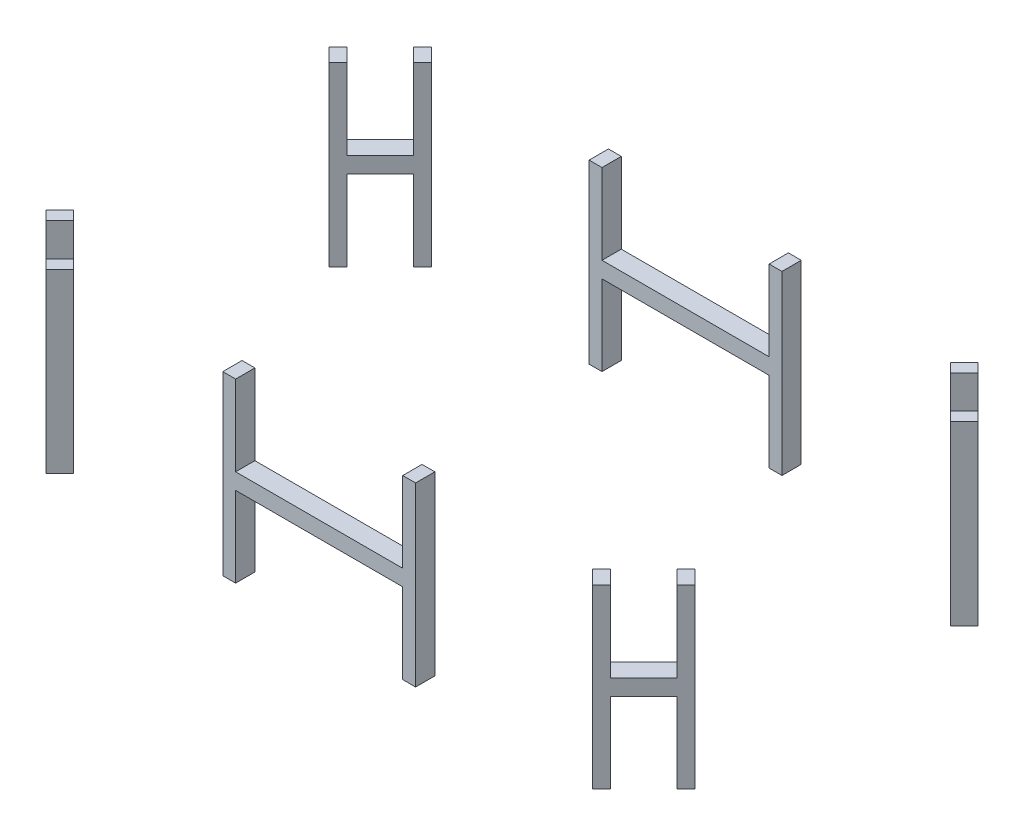
from build123d import *

# Parameters (mm, degrees)
EXTRUDE_1_DEPTH          = 275
EXTRUDE_1_2_DEPTH        = 275
EXTRUDE_1_3_DEPTH        = 275
EXTRUDE_1_4_DEPTH        = 275
EXTRUDE_1_5_DEPTH        = 275
EXTRUDE_1_6_DEPTH        = 275
CUT_EXTRUDE_1_DEPTH      = 832.053548215
CUT_EXTRUDE_1_DEPTH_BACK = 832.053548215
SKETCH_2_W               = 260
SKETCH_2_H               = 125
SKETCH_3_W               = 73.13708499
SKETCH_3_H               = 125
CUT_EXTRUDE_2_DEPTH      = 30
SKETCH_4_W               = 73.13708499
SKETCH_4_H               = 125
CUT_EXTRUDE_3_DEPTH      = 30
SKETCH_5_W               = 73.13708499
SKETCH_5_H               = 125
CUT_EXTRUDE_4_DEPTH      = 30
SKETCH_6_W               = 73.13708499
SKETCH_6_H               = 125
CUT_EXTRUDE_5_DEPTH      = 30


with BuildPart() as part:
    # 草图1 → 凸台-拉伸1 (new body)
    with BuildSketch(Plane(origin=(0, 0, 0), x_dir=(1, 0, 0), z_dir=(0, 1, 0))):
        Polygon((-505, 220), (-425, 300), (-403.786796564, 278.786796564), (-483.786796564, 198.786796564), align=None)
    extrude(amount=EXTRUDE_1_DEPTH)

    # 草图5 → 切除-拉伸4 (cut)
    with BuildSketch(Plane(origin=(-362.5, 0, -362.5), x_dir=(-0.7071067811865475, 0, 0.7071067811865477), z_dir=(-0.7071067811865477, 0, -0.7071067811865475))):
        with Locations((144.956890143, 212.5)):
            Rectangle(SKETCH_5_W, SKETCH_5_H)
        with Locations((144.956890143, 62.5)):
            Rectangle(SKETCH_5_W, SKETCH_5_H)
    extrude(amount=-CUT_EXTRUDE_4_DEPTH, mode=Mode.SUBTRACT)


with BuildPart() as body_2:
    # 草图1 → Extrude 1 2 (new body)
    with BuildSketch(Plane(origin=(0, 0, 0), x_dir=(1, 0, 0), z_dir=(0, 1, 0))):
        Polygon((-150, 270), (150, 270), (150, 300), (0, 300), (-150, 300), align=None)
    extrude(amount=EXTRUDE_1_2_DEPTH)


with BuildPart() as body_3:
    # 草图1 → Extrude 1 3 (new body)
    with BuildSketch(Plane(origin=(0, 0, 0), x_dir=(1, 0, 0), z_dir=(0, 1, 0))):
        Polygon((505, 220), (483.786796564, 198.786796564), (403.786796564, 278.786796564), (425, 300), align=None)
    extrude(amount=EXTRUDE_1_3_DEPTH)

    # 草图4 → 切除-拉伸3 (cut)
    with BuildSketch(Plane(origin=(362.5, 0, -362.5), x_dir=(-0.7071067811865475, 0, -0.7071067811865477), z_dir=(0.7071067811865477, 0, -0.7071067811865475))):
        with Locations((-144.956890143, 212.5)):
            Rectangle(SKETCH_4_W, SKETCH_4_H)
        with Locations((-144.956890143, 62.5)):
            Rectangle(SKETCH_4_W, SKETCH_4_H)
    extrude(amount=-CUT_EXTRUDE_3_DEPTH, mode=Mode.SUBTRACT)


with BuildPart() as body_4:
    # 草图1 → Extrude 1 4 (new body)
    with BuildSketch(Plane(origin=(0, 0, 0), x_dir=(1, 0, 0), z_dir=(0, 1, 0))):
        Polygon((505, -220), (425, -300), (403.786796564, -278.786796564), (483.786796564, -198.786796564), align=None)
    extrude(amount=EXTRUDE_1_4_DEPTH)

    # 草图3 → 切除-拉伸2 (cut)
    with BuildSketch(Plane(origin=(362.5, 0, 362.5), x_dir=(0.7071067811865475, 0, -0.7071067811865477), z_dir=(0.7071067811865477, 0, 0.7071067811865475))):
        with Locations((144.956890143, 212.5)):
            Rectangle(SKETCH_3_W, SKETCH_3_H)
        with Locations((144.956890143, 62.5)):
            Rectangle(SKETCH_3_W, SKETCH_3_H)
    extrude(amount=-CUT_EXTRUDE_2_DEPTH, mode=Mode.SUBTRACT)


with BuildPart() as body_5:
    # 草图1 → Extrude 1 5 (new body)
    with BuildSketch(Plane(origin=(0, 0, 0), x_dir=(1, 0, 0), z_dir=(0, 1, 0))):
        Polygon((-150, -300), (-150, -270), (150, -270), (150, -300), (0, -300), align=None)
    extrude(amount=EXTRUDE_1_5_DEPTH)


with BuildPart() as body_6:
    # 草图1 → Extrude 1 6 (new body)
    with BuildSketch(Plane(origin=(0, 0, 0), x_dir=(1, 0, 0), z_dir=(0, 1, 0))):
        Polygon((-505, -220), (-483.786796564, -198.786796564), (-403.786796564, -278.786796564), (-425, -300), align=None)
    extrude(amount=EXTRUDE_1_6_DEPTH)

    # 草图6 → 切除-拉伸5 (cut)
    with BuildSketch(Plane(origin=(-362.5, 0, 362.5), x_dir=(0.7071067811865475, 0, 0.7071067811865477), z_dir=(-0.7071067811865477, 0, 0.7071067811865475))):
        with Locations((-144.956890143, 212.5)):
            Rectangle(SKETCH_6_W, SKETCH_6_H)
        with Locations((-144.956890143, 62.5)):
            Rectangle(SKETCH_6_W, SKETCH_6_H)
    extrude(amount=-CUT_EXTRUDE_5_DEPTH, mode=Mode.SUBTRACT)


with BuildPart() as cut_extrude_1_tool:
    # 草图2 → 切除-拉伸1 (new, two sides: drawn at the far end of the back side and taken through both)
    with BuildSketch(Plane.XY.offset(300).offset(-CUT_EXTRUDE_1_DEPTH_BACK)):
        with Locations((0, 212.5)):
            Rectangle(SKETCH_2_W, SKETCH_2_H)
        with Locations((0, 62.5)):
            Rectangle(SKETCH_2_W, SKETCH_2_H)
    extrude(amount=CUT_EXTRUDE_1_DEPTH + CUT_EXTRUDE_1_DEPTH_BACK)


with BuildPart() as body_2_1:
    add(body_2.part)

    # 切除-拉伸1: cut by cut_extrude_1_tool
    add(cut_extrude_1_tool.part, mode=Mode.SUBTRACT)


with BuildPart() as body_5_1:
    add(body_5.part)

    # 切除-拉伸1: cut by cut_extrude_1_tool
    add(cut_extrude_1_tool.part, mode=Mode.SUBTRACT)


solid = Compound([part.part, body_3.part, body_4.part, body_6.part, body_2_1.part, body_5_1.part])
